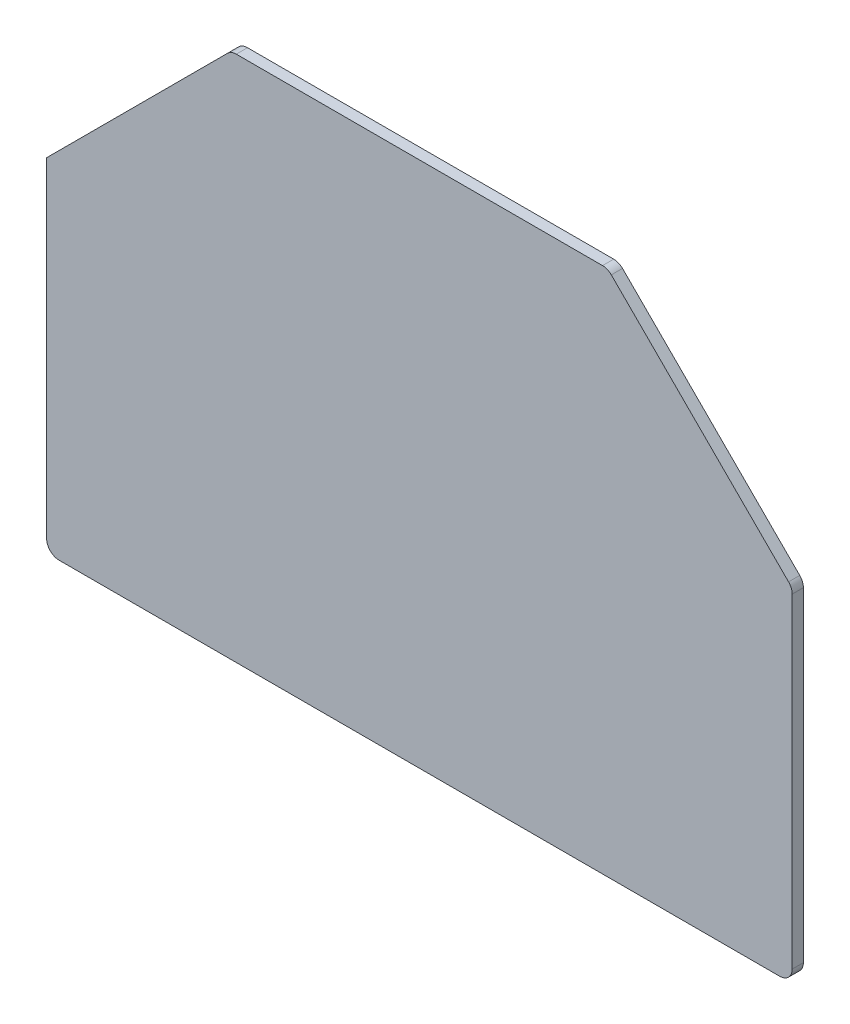
from build123d import *

# Parameters (mm, degrees)
BOSS_EXTRUDE1_DEPTH = 4.5
FILLET1_R           = 5


with BuildPart() as part:
    # Sketch1 → Boss-Extrude1 (new body)
    with BuildSketch(Plane.XY):
        Polygon((0, 137.753787975), (74.246212025, 212), (225.753787975, 212), (300, 137.753787975), (300, 0), (0, 0), align=None)
    extrude(amount=BOSS_EXTRUDE1_DEPTH)

    # Fillet1
    fillet1_edges = [part.edges().sort_by_distance(p)[0] for p in [
        (74.246212025, 212, 2.25),
        (225.753787975, 212, 2.25),
        (300, 137.753787975, 2.25),
        (300, 0, 2.25),
        (0, 0, 2.25),
    ]]
    fillet(fillet1_edges, radius=FILLET1_R)


solid = part.part
